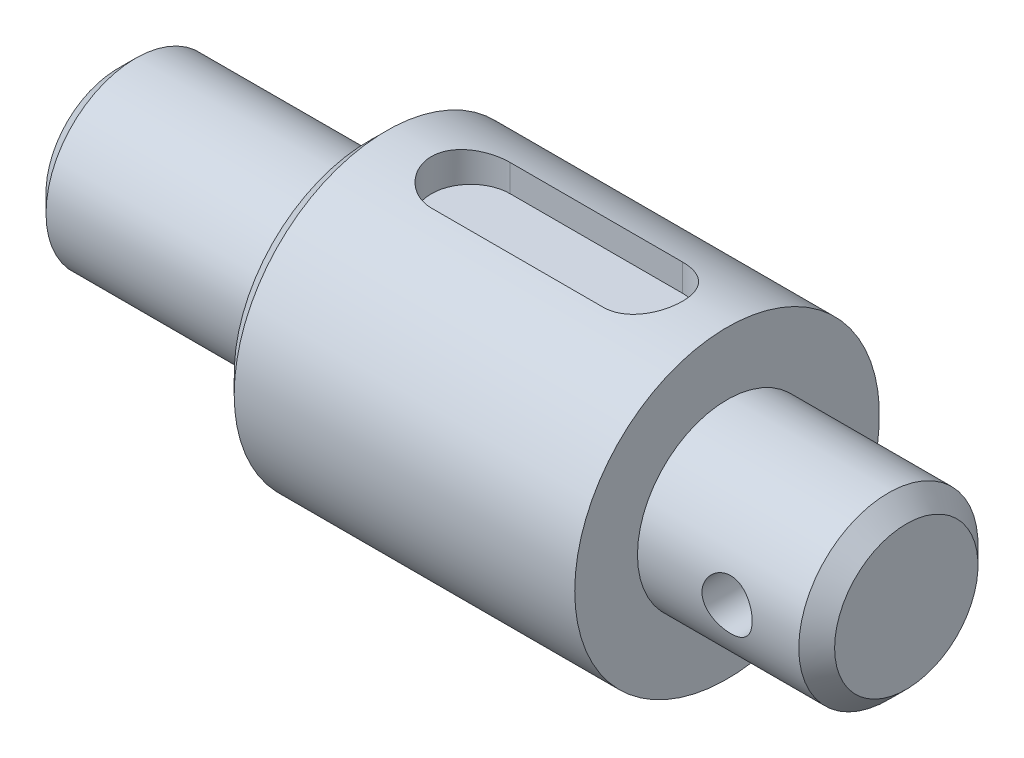
from build123d import *

# Parameters (mm, degrees)
CHAMFER_1_SIZE      = 5
CUT_EXTRUDE_START   = 33.5
CUT_EXTRUDE_1_DEPTH = 129.093626112


with BuildPart() as part:
    # Эскиз1 → Повернуть1 (revolve)
    with BuildSketch(Plane.XY, mode=Mode.PRIVATE) as revolve_1_sk:
        Polygon((-70, 0), (-70, 25), (0, 25), (0, 42.5), (100, 42.5), (100, 25), (150, 25), (150, 0), align=None)
    revolve(revolve_1_sk.sketch.rotate(Axis((0, 0, 0), (1, 0, 0)), 90), axis=Axis((0, 0, 0), (1, 0, 0)))

    # Фаска1
    chamfer_1_edges = [part.edges().sort_by_distance(p)[0] for p in [
        (150, 0, -25),
        (0, 0, -42.5),
        (-70, 0, -25),
    ]]
    chamfer(chamfer_1_edges, length=CHAMFER_1_SIZE)

    # Эскиз2 → Вырез-Повернуть1 (revolve, cut)
    with BuildSketch(Plane.XY, mode=Mode.PRIVATE) as cut_revolve_1_sk:
        with BuildLine():
            Line((0, 25), (0, 24.5))
            ThreePointArc((0, 24.5), (-0.585786438, 23.085786438), (-2, 22.5))
            Line((-2, 22.5), (-5.085786438, 22.5))
            ThreePointArc((-5.085786438, 22.5), (-5.46846987, 22.576120467), (-5.792893219, 22.792893219))
            Line((-5.792893219, 22.792893219), (-8, 25))
            Line((-8, 25), (0, 25))
        make_face()
    revolve(cut_revolve_1_sk.sketch.rotate(Axis((0, 0, 0), (1, 0, 0)), 90), axis=Axis((0, 0, 0), (1, 0, 0)), mode=Mode.SUBTRACT)

    # Эскиз3 → Вырез-Вытянуть1 (cut, through all)
    with BuildSketch(Plane(origin=(0, 0, 0), x_dir=(1, 0, 0), z_dir=(0, 1, 0)).offset(CUT_EXTRUDE_START)):
        with BuildLine():
            Line((28.5, 11), (76.5, 11))
            ThreePointArc((76.5, 11), (87.5, 0), (76.5, -11))
            Line((76.5, -11), (28.5, -11))
            ThreePointArc((28.5, -11), (17.5, 0), (28.5, 11))
        make_face()
    extrude(amount=CUT_EXTRUDE_1_DEPTH, mode=Mode.SUBTRACT)

    # Эскиз4 → Вырез-Повернуть3 (revolve, cut)
    with BuildSketch(Plane(origin=(125, 0, 0), x_dir=(0, 0, -1), z_dir=(1, 0, 0))):
        Polygon((-10, 0), (-14.041451884, 7), (-25, 7), (-25, 0), align=None)
    revolve(axis=Axis((125, 0, 10), (0, 0, 1)), mode=Mode.SUBTRACT)


solid = part.part
